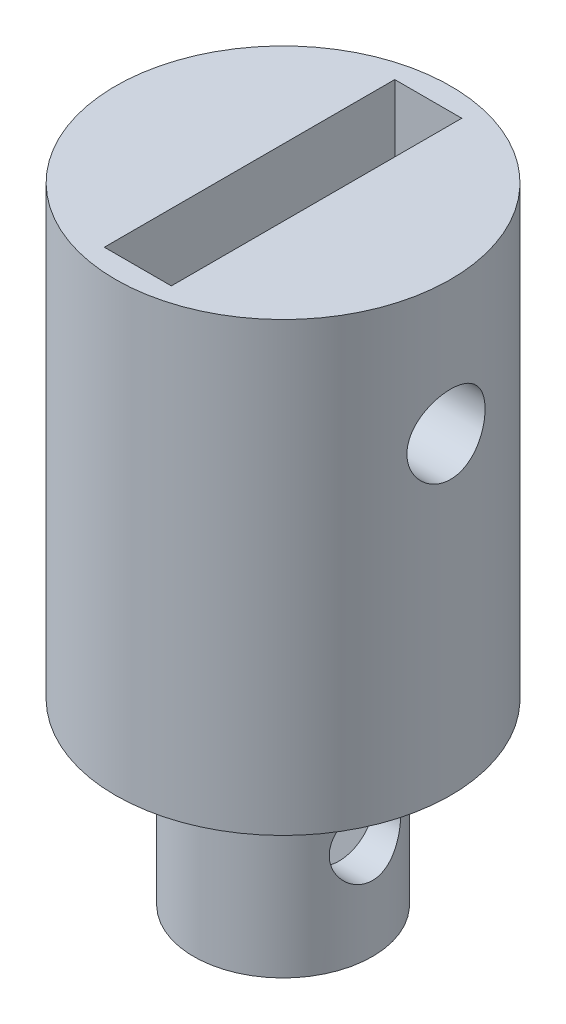
from build123d import *

# Parameters (mm, degrees)
SKETCH1_R           = 7.5
BOSS_EXTRUDE1_DEPTH = 20
SKETCH2_W           = 3
SKETCH2_H           = 13
CUT_EXTRUDE1_DEPTH  = 10
SKETCH3_R           = 1.75
CUT_EXTRUDE2_DEPTH  = 27.100766272
SKETCH4_R           = 4
BOSS_EXTRUDE2_DEPTH = 8
SKETCH5_W           = 5
SKETCH5_H           = 4
CUT_EXTRUDE3_DEPTH  = 6.2
SKETCH6_R           = 1.6
CUT_EXTRUDE4_DEPTH  = 27.100766436


with BuildPart() as part:
    # Sketch1 → Boss-Extrude1 (new body)
    with BuildSketch(Plane(origin=(0, 0, 0), x_dir=(1, 0, 0), z_dir=(0, 1, 0))):
        with Locations(Location((0, 0, 0), (0, 0, 270))):
            Circle(SKETCH1_R)
    extrude(amount=BOSS_EXTRUDE1_DEPTH)

    # Sketch2 → Cut-Extrude1 (cut)
    with BuildSketch(Plane(origin=(0, 20, 0), x_dir=(1, 0, 0), z_dir=(0, 1, 0))):
        Rectangle(SKETCH2_W, SKETCH2_H)
    extrude(amount=-CUT_EXTRUDE1_DEPTH, mode=Mode.SUBTRACT)

    # Sketch3 → Cut-Extrude2 (cut, through all)
    with BuildSketch(Plane(origin=(7.5, 0, 0), x_dir=(0, 0, -1), z_dir=(1, 0, 0))):
        with Locations((0, 14)):
            Circle(SKETCH3_R)
    extrude(amount=-CUT_EXTRUDE2_DEPTH, mode=Mode.SUBTRACT)

    # Sketch4 → Boss-Extrude2 (add)
    with BuildSketch(Plane.XZ):
        with Locations(Location((0, 0, 0), (0, 0, 270))):
            Circle(SKETCH4_R)
    extrude(amount=BOSS_EXTRUDE2_DEPTH)

    # Sketch5 → Cut-Extrude3 (cut)
    with BuildSketch(Plane.XZ.offset(8)):
        Rectangle(SKETCH5_W, SKETCH5_H)
    extrude(amount=-CUT_EXTRUDE3_DEPTH, mode=Mode.SUBTRACT)

    # Sketch6 → Cut-Extrude4 (cut, through all)
    with BuildSketch(Plane(origin=(7.5, 0, 0), x_dir=(0, 0, -1), z_dir=(1, 0, 0))):
        with Locations((0, -3.45)):
            Circle(SKETCH6_R)
    extrude(amount=-CUT_EXTRUDE4_DEPTH, mode=Mode.SUBTRACT)


solid = part.part
